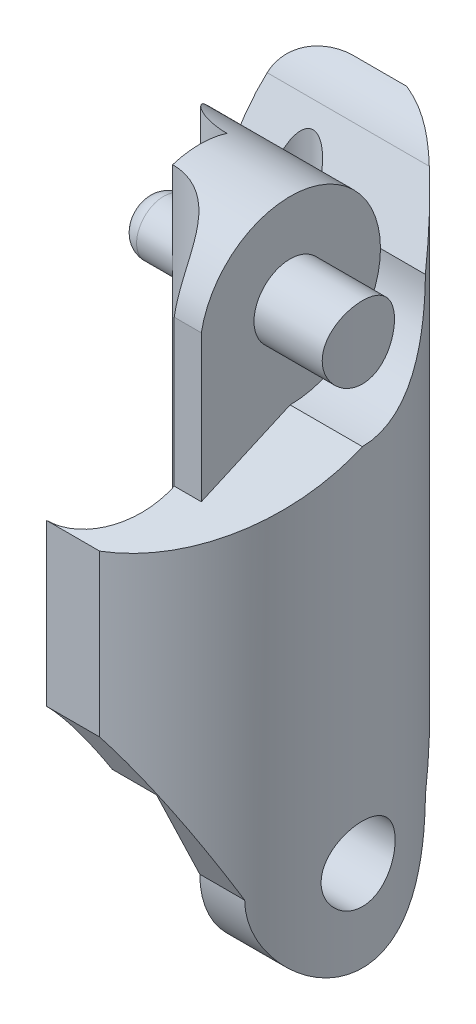
from build123d import *

# Parameters (mm, degrees)
BOSS_EXTRUDE1_DEPTH = 35
SKETCH2_R           = 1.27
CUT_EXTRUDE1_DEPTH  = 35
CUT_EXTRUDE2_REACH  = 41.937
SKETCH3_W           = 10
SKETCH3_H           = 10
SKETCH4_R           = 2.049999964
CUT_EXTRUDE3_DEPTH  = 17.5
CUT_EXTRUDE5_START  = -7.95804
SKETCH6_R           = 2
CUT_EXTRUDE5_DEPTH  = 9.6
FILLET3_R           = 1
CUT_EXTRUDE6_START  = 8.64596
SKETCH6_3_R         = 2
CUT_EXTRUDE6_DEPTH  = 6.604
CUT_EXTRUDE7_START  = -14.986
CUT_EXTRUDE7_DEPTH  = 14.986
CUT_EXTRUDE8_DEPTH  = 31.496
SKETCH9_R           = 1.5
CUT_EXTRUDE9_DEPTH  = 8.382
SKETCH11_R          = 2
CUT_EXTRUDE10_DEPTH = 3.1
BOSS_EXTRUDE2_DEPTH = 3.862
SKETCH13_R          = 1.5
BOSS_EXTRUDE3_DEPTH = 3
FILLET4_R           = 1


with BuildPart() as part:
    # Sketch1 → Boss-Extrude1 (new body)
    with BuildSketch(Plane(origin=(0, 0, 0), x_dir=(1, 0, 0), z_dir=(0, 1, 0))):
        with BuildLine():
            Line((-2.958039892, 8.5), (2.958039892, 8.5))
            ThreePointArc((2.958039892, 8.5), (9, 0), (2.958039892, -8.5))
            Line((2.958039892, -8.5), (-2.958039892, -8.5))
            ThreePointArc((-2.958039892, -8.5), (-9, 0), (-2.958039892, 8.5))
        make_face()
    extrude(amount=BOSS_EXTRUDE1_DEPTH)

    # Sketch2 → Cut-Extrude1 (cut)
    with BuildSketch(Plane.XZ):
        with Locations(Location((0, -5, 0), (0, 0, 270))):
            Circle(SKETCH2_R)
        with Locations(Location((0, 5, 0), (0, 0, 270))):
            Circle(SKETCH2_R)
    extrude(amount=-CUT_EXTRUDE1_DEPTH, mode=Mode.SUBTRACT)

    # Cut-Extrude2: up to this face of the body (flat: up to its plane)
    cut_extrude2_end = Plane(part.part.faces().sort_by_distance((0, 17.5, 8.5))[0])
    # Sketch3 → Cut-Extrude2 (cut, up to the picked face)
    with BuildSketch(Plane(origin=(0, 0, -8.5), x_dir=(-1, 0, 0), z_dir=(0, 0, -1)), mode=Mode.PRIVATE) as cut_extrude2_sk1:
        with Locations((0, 5)):
            Rectangle(SKETCH3_W, SKETCH3_H)
    cut_extrude2_tool1 = split(extrude(cut_extrude2_sk1.sketch, amount=-CUT_EXTRUDE2_REACH, mode=Mode.PRIVATE), bisect_by=cut_extrude2_end, keep=Keep.BOTH, mode=Mode.PRIVATE)
    add(cut_extrude2_tool1.solids().sort_by(Axis((0, 5, -8.5), (0, 0, 1)))[0], mode=Mode.SUBTRACT)

    # Sketch4 → Cut-Extrude3 (cut, symmetric)
    with BuildSketch(Plane.ZY.offset(-5)):
        with Locations(Location((0, 5, 0), (0, 0, 270))):
            Circle(SKETCH4_R)
        with BuildLine():
            Line((-7.483314774, 10), (-5, 5))
            ThreePointArc((-5, 5), (0, 0), (5, 5))
            Line((5, 5), (8.5, 12.308552788))
            Line((8.5, 12.308552788), (9.857943437, -1.822240199))
            Line((9.857943437, -1.822240199), (-9.857943437, -1.822240199))
            Line((-9.857943437, -1.822240199), (-7.483314774, 10))
        make_face()
    extrude(amount=CUT_EXTRUDE3_DEPTH, both=True, mode=Mode.SUBTRACT)

    # Sketch6 → Cut-Extrude5 (cut)
    with BuildSketch(Plane.ZY.offset(2.958039892).offset(CUT_EXTRUDE5_START)):
        with BuildLine():
            Line((8.5, 21.219917379), (0, 25))
            ThreePointArc((0, 25), (-3.535533906, 26.464466094), (-5, 30))
            Line((-5, 30), (-6.755867779, 33.535330675))
            ThreePointArc((-6.755867779, 33.535330675), (-7.475170692, 34.449576169), (-8.5, 35))
            Line((-8.5, 35), (17.803004008, 42.886049022))
            Line((17.803004008, 42.886049022), (8.5, 21.219917379))
        make_face()
        with Locations((0, 30)):
            Circle(SKETCH6_R, mode=Mode.SUBTRACT)
    extrude(amount=-CUT_EXTRUDE5_DEPTH, mode=Mode.SUBTRACT)

    # Fillet3
    fillet3_edges = [part.edges().sort_by_distance(p)[0] for p in [
        (0, 10, -3.73),
        (0, 10, 6.27),
    ]]
    fillet(fillet3_edges, radius=FILLET3_R)

    # Sketch6<3> → Cut-Extrude6 (cut)
    with BuildSketch(Plane.ZY.offset(2.958039892).offset(CUT_EXTRUDE6_START)):
        with BuildLine():
            Line((8.5, 21.219917379), (0, 25))
            ThreePointArc((0, 25), (-3.535533906, 26.464466094), (-5, 30))
            Line((-5, 30), (-6.755867779, 33.535330675))
            ThreePointArc((-6.755867779, 33.535330675), (-7.475170692, 34.449576169), (-8.5, 35))
            Line((-8.5, 35), (17.803004008, 42.886049022))
            Line((17.803004008, 42.886049022), (8.5, 21.219917379))
        make_face()
        with Locations((0, 30)):
            Circle(SKETCH6_3_R, mode=Mode.SUBTRACT)
    extrude(amount=-CUT_EXTRUDE6_DEPTH, mode=Mode.SUBTRACT)

    # Sketch7 → Cut-Extrude7 (cut)
    with BuildSketch(Plane(origin=(5, 0, 0), x_dir=(0, 0, -1), z_dir=(1, 0, 0)).offset(CUT_EXTRUDE7_START)):
        with BuildLine():
            Line((5, 30), (6.755867779, 33.535330675))
            ThreePointArc((6.755867779, 33.535330675), (7.475170692, 34.449576169), (8.5, 35))
            Line((8.5, 35), (-8.341946035, 47.536710192))
            Line((-8.341946035, 47.536710192), (-13.168237897, 33.528506419))
            Line((-13.168237897, 33.528506419), (-10.04678731, 20.532036929))
            Line((-10.04678731, 20.532036929), (-4.915473018, 22.814012455))
            Line((-4.915473018, 22.814012455), (-4.915473018, 30.915491676))
            ThreePointArc((-4.915473018, 30.915491676), (0.459692783, 34.97882341), (5, 30))
        make_face()
    extrude(amount=CUT_EXTRUDE7_DEPTH, mode=Mode.SUBTRACT)

    # Sketch8 → Cut-Extrude8 (cut, symmetric)
    with BuildSketch(Plane.XZ.offset(-10)):
        with BuildLine():
            Line((0, 1.5), (0, -1.5))
            ThreePointArc((0, -1.5), (-3.5, -5), (0, -8.5))
            Line((0, -8.5), (-4.790142834, -16.013604782))
            Line((-4.790142834, -16.013604782), (-17.855559142, -9.717705198))
            Line((-17.855559142, -9.717705198), (-4.790142834, 15.219000931))
            Line((-4.790142834, 15.219000931), (0, 8.5))
            ThreePointArc((0, 8.5), (3.5, 5), (0, 1.5))
        make_face()
    extrude(amount=CUT_EXTRUDE8_DEPTH, both=True, mode=Mode.SUBTRACT)

    # Sketch9 → Cut-Extrude9 (cut)
    with BuildSketch(Plane.ZY):
        with Locations((0, 16)):
            Circle(SKETCH9_R)
    extrude(amount=-CUT_EXTRUDE9_DEPTH, mode=Mode.SUBTRACT)

    # Sketch11 → Cut-Extrude10 (cut, symmetric)
    with BuildSketch(Plane.ZY):
        with Locations((0, 16)):
            Circle(SKETCH11_R)
    extrude(amount=CUT_EXTRUDE10_DEPTH, both=True, mode=Mode.SUBTRACT)

    # Sketch12 → Boss-Extrude2 (add)
    with BuildSketch(Plane.ZY):
        with BuildLine():
            Line((0, 18), (0, 19.5))
            ThreePointArc((0, 19.5), (3.5, 16), (0, 12.5))
            Line((0, 12.5), (0, 14))
            ThreePointArc((0, 14), (2, 16), (0, 18))
        make_face()
    extrude(amount=-BOSS_EXTRUDE2_DEPTH)

    # Sketch13 → Boss-Extrude3 (add)
    with BuildSketch(Plane.ZY):
        with Locations((0, 30)):
            Circle(SKETCH13_R)
    extrude(amount=BOSS_EXTRUDE3_DEPTH)

    # Fillet4
    fillet4_edges = [part.edges().sort_by_distance(p)[0] for p in [
        (-3, 30, -1.5),
    ]]
    fillet(fillet4_edges, radius=FILLET4_R)


solid = part.part
